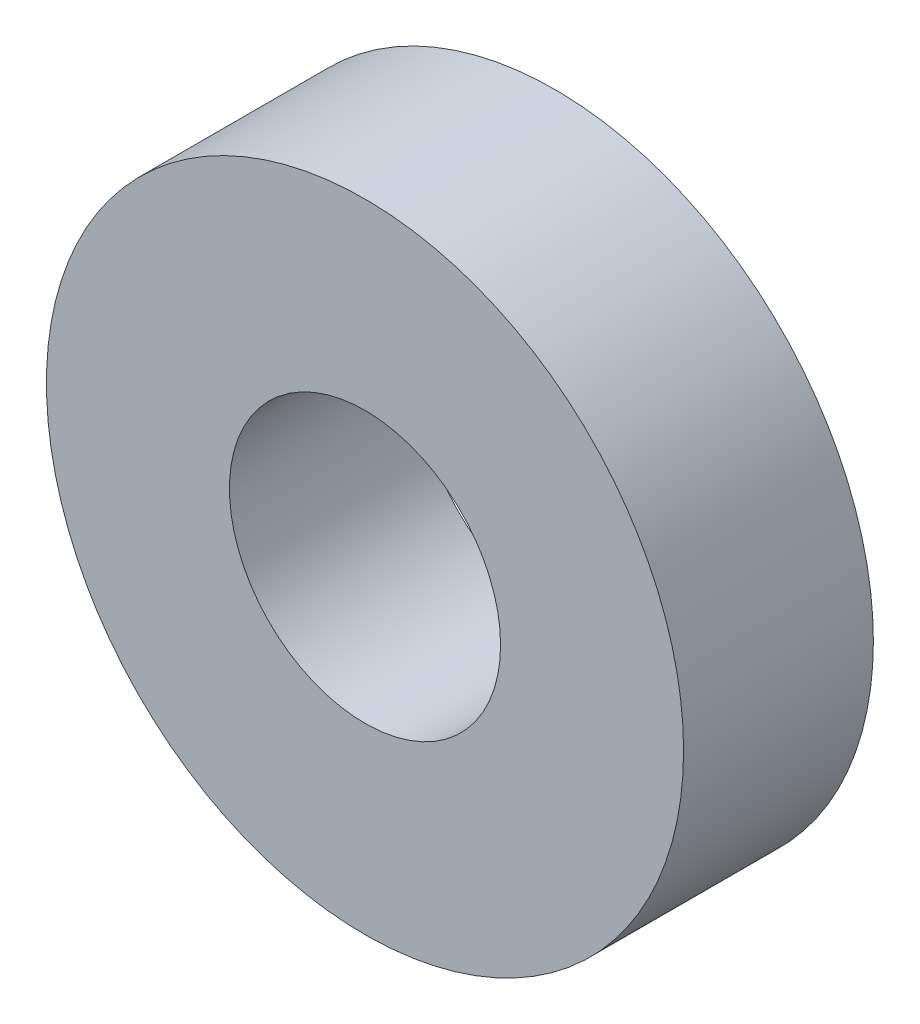
from build123d import *

# Parameters (mm, degrees)
SKETCH1_R           = 23.5
SKETCH1_R_2         = 10
BOSS_EXTRUDE1_DEPTH = 14


with BuildPart() as part:
    # Sketch1 → Boss-Extrude1 (new body)
    with BuildSketch(Plane.XY):
        Circle(SKETCH1_R)
        Circle(SKETCH1_R_2, mode=Mode.SUBTRACT)
    extrude(amount=BOSS_EXTRUDE1_DEPTH)


solid = part.part
